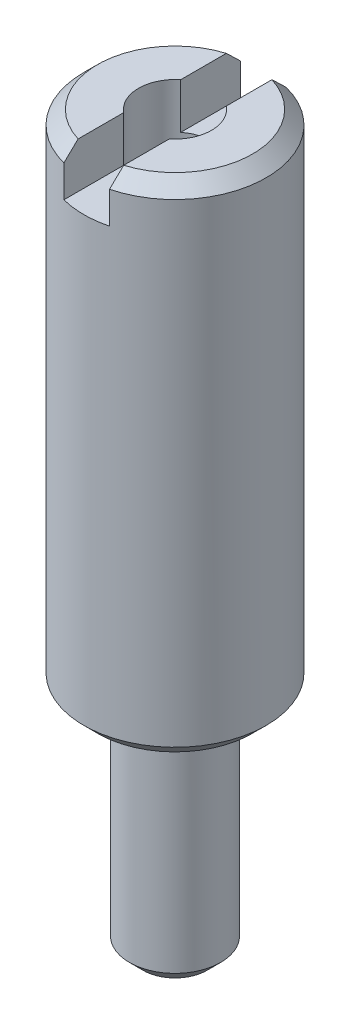
from build123d import *

# Parameters (mm, degrees)
CHAMFER_1_SIZE         = 0.3
CUT_EXTRUDE_2_DEPTH    = 1
HOLE_WIZARD_M2_1_D     = 1.6
HOLE_WIZARD_M2_1_DEPTH = 8
HOLE_WIZARD_M2_1_TIP   = 0.480688495


with BuildPart() as part:
    # ｽｹｯﾁ1 → 回転1 (revolve)
    with BuildSketch(Plane.XY):
        Polygon((0, -5), (-1, -5), (-1, 0), (-2, 0), (-2, 11), (0, 11), align=None)
    revolve(axis=Axis((0, 16.004822162, 0), (0, -1, 0)))

    # 面取り1
    chamfer_1_edges = [part.edges().sort_by_distance(p)[0] for p in [
        (2, 11, 0),
        (2, 0, 0),
        (1, -5, 0),
    ]]
    chamfer(chamfer_1_edges, length=CHAMFER_1_SIZE)

    # ｽｹｯﾁ2 → ｶｯﾄ - 押し出し2 (cut)
    with BuildSketch(Plane(origin=(0, 11, 0), x_dir=(1, 0, 0), z_dir=(0, 1, 0))):
        with BuildLine():
            Line((0.5, -1.936491673), (0.5, 1.936491673))
            ThreePointArc((0.5, 1.936491673), (0, 2), (-0.5, 1.936491673))
            Line((-0.5, 1.936491673), (-0.5, -1.936491673))
            ThreePointArc((-0.5, -1.936491673), (0, -2), (0.5, -1.936491673))
        make_face()
    extrude(amount=-CUT_EXTRUDE_2_DEPTH, mode=Mode.SUBTRACT)

    # M2 ねじ穴1
    with Locations(Plane(origin=(0, 11, 0), x_dir=(1, 0, 0), z_dir=(0, 1, 0))):
        with Locations((0, 0)):
            Hole(HOLE_WIZARD_M2_1_D / 2, depth=HOLE_WIZARD_M2_1_DEPTH)
            with Locations((0, 0, -(HOLE_WIZARD_M2_1_DEPTH + HOLE_WIZARD_M2_1_TIP / 2))):  # 118° drill point
                Cone(0, HOLE_WIZARD_M2_1_D / 2, HOLE_WIZARD_M2_1_TIP, mode=Mode.SUBTRACT)


solid = part.part
